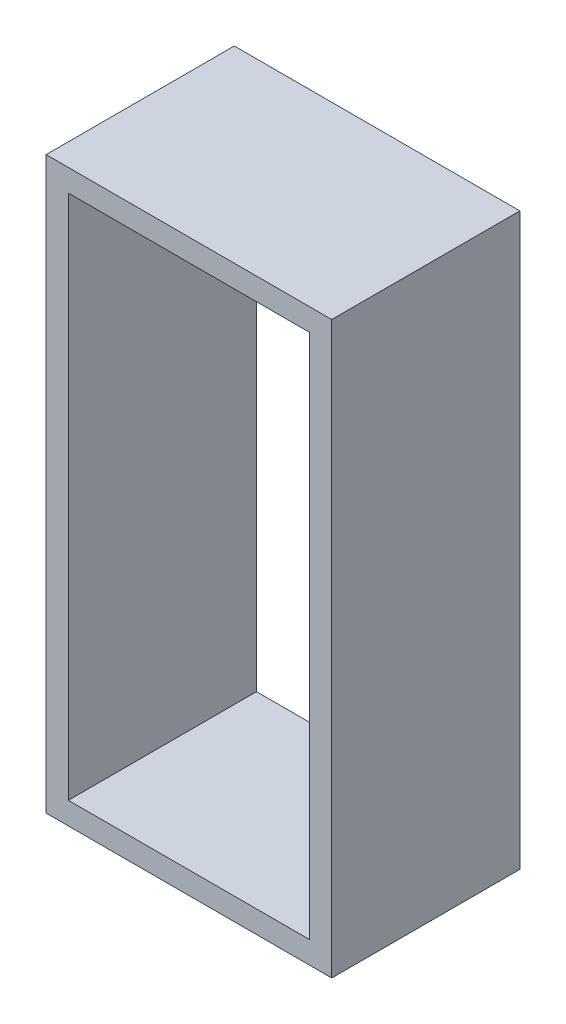
from build123d import *

# Parameters (mm, degrees)
STRAP_SKETCH_W   = 19.28
STRAP_SKETCH_H   = 38.5
STRAP_SKETCH_W_2 = 16.28
STRAP_SKETCH_H_2 = 35.5
STRAP_DEPTH      = 6.35


with BuildPart() as part:
    # Strap Sketch → Strap (new, symmetric)
    with BuildSketch(Plane.XY):
        with Locations((-4.91, -24.5)):
            Rectangle(STRAP_SKETCH_W, STRAP_SKETCH_H)
        with Locations((-4.91, -24.5)):
            Rectangle(STRAP_SKETCH_W_2, STRAP_SKETCH_H_2, mode=Mode.SUBTRACT)
    extrude(amount=STRAP_DEPTH, both=True)


solid = part.part
